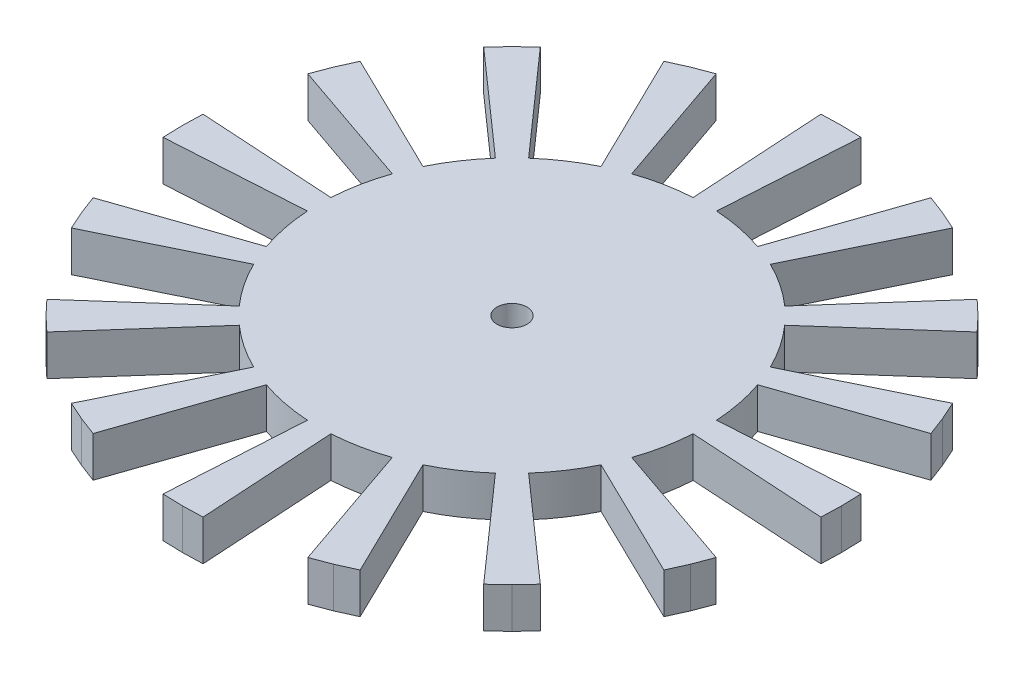
from build123d import *

# Parameters (mm, degrees)
SKETCH2_R           = 1.89865
BOSS_EXTRUDE1_DEPTH = 5.1308


with BuildPart() as part:
    # Sketch2 → Boss-Extrude1 (new body)
    with BuildSketch(Plane(origin=(0, 0, 0), x_dir=(1, 0, 0), z_dir=(0, 1, 0))):
        with BuildLine():
            Line((-13.614547531, 39.502698446), (-15.989661855, 38.602458507))
            Line((-15.989661855, 38.602458507), (-18.305687065, 37.559564828))
            Line((-18.305687065, 37.559564828), (-10.733030501, 22.022006247))
            ThreePointArc((-10.733030501, 22.022006247), (-13.61052624, 20.369592003), (-16.238327885, 18.34348414))
            Line((-16.238327885, 18.34348414), (-27.695230037, 31.285672794))
            Line((-27.695230037, 31.285672794), (-29.545042638, 29.545042638))
            Line((-29.545042638, 29.545042638), (-31.285672794, 27.695230037))
            Line((-31.285672794, 27.695230037), (-18.34348414, 16.238327885))
            ThreePointArc((-18.34348414, 16.238327885), (-20.369592003, 13.61052624), (-22.022006247, 10.733030501))
            Line((-22.022006247, 10.733030501), (-37.559564828, 18.305687065))
            Line((-37.559564828, 18.305687065), (-38.602458507, 15.989661855))
            Line((-38.602458507, 15.989661855), (-39.502698446, 13.614547531))
            Line((-39.502698446, 13.614547531), (-23.161308603, 7.982511303))
            ThreePointArc((-23.161308603, 7.982511303), (-24.027572035, 4.779381236), (-24.453033788, 1.488570263))
            Line((-24.453033788, 1.488570263), (-41.705796353, 2.538826421))
            Line((-41.705796353, 2.538826421), (-41.783, 0))
            Line((-41.783, 0), (-41.705796353, -2.538826421))
            Line((-41.705796353, -2.538826421), (-24.453033788, -1.488570263))
            ThreePointArc((-24.453033788, -1.488570263), (-24.027572035, -4.779381236), (-23.161308603, -7.982511303))
            Line((-23.161308603, -7.982511303), (-39.502698446, -13.614547531))
            Line((-39.502698446, -13.614547531), (-38.602458507, -15.989661855))
            Line((-38.602458507, -15.989661855), (-37.559564828, -18.305687065))
            Line((-37.559564828, -18.305687065), (-22.022006247, -10.733030501))
            ThreePointArc((-22.022006247, -10.733030501), (-20.369592003, -13.61052624), (-18.34348414, -16.238327885))
            Line((-18.34348414, -16.238327885), (-31.285672794, -27.695230037))
            Line((-31.285672794, -27.695230037), (-29.545042638, -29.545042638))
            Line((-29.545042638, -29.545042638), (-27.695230037, -31.285672794))
            Line((-27.695230037, -31.285672794), (-16.238327885, -18.34348414))
            ThreePointArc((-16.238327885, -18.34348414), (-13.61052624, -20.369592003), (-10.733030501, -22.022006247))
            Line((-10.733030501, -22.022006247), (-18.305687065, -37.559564828))
            Line((-18.305687065, -37.559564828), (-15.989661855, -38.602458507))
            Line((-15.989661855, -38.602458507), (-13.614547531, -39.502698446))
            Line((-13.614547531, -39.502698446), (-7.982511303, -23.161308603))
            ThreePointArc((-7.982511303, -23.161308603), (-4.779381236, -24.027572035), (-1.488570263, -24.453033788))
            Line((-1.488570263, -24.453033788), (-2.538826421, -41.705796353))
            Line((-2.538826421, -41.705796353), (0, -41.783))
            Line((0, -41.783), (2.538826421, -41.705796353))
            Line((2.538826421, -41.705796353), (1.488570263, -24.453033788))
            ThreePointArc((1.488570263, -24.453033788), (4.779381236, -24.027572035), (7.982511303, -23.161308603))
            Line((7.982511303, -23.161308603), (13.614547531, -39.502698446))
            Line((13.614547531, -39.502698446), (15.989661855, -38.602458507))
            Line((15.989661855, -38.602458507), (18.305687065, -37.559564828))
            Line((18.305687065, -37.559564828), (10.733030501, -22.022006247))
            ThreePointArc((10.733030501, -22.022006247), (13.61052624, -20.369592003), (16.238327885, -18.34348414))
            Line((16.238327885, -18.34348414), (27.695230037, -31.285672794))
            Line((27.695230037, -31.285672794), (29.545042638, -29.545042638))
            Line((29.545042638, -29.545042638), (31.285672794, -27.695230037))
            Line((31.285672794, -27.695230037), (18.34348414, -16.238327885))
            ThreePointArc((18.34348414, -16.238327885), (20.369592003, -13.61052624), (22.022006247, -10.733030501))
            Line((22.022006247, -10.733030501), (37.559564828, -18.305687065))
            Line((37.559564828, -18.305687065), (38.602458507, -15.989661855))
            Line((38.602458507, -15.989661855), (39.502698446, -13.614547531))
            Line((39.502698446, -13.614547531), (23.161308603, -7.982511303))
            ThreePointArc((23.161308603, -7.982511303), (24.027572035, -4.779381236), (24.453033788, -1.488570263))
            Line((24.453033788, -1.488570263), (41.705796353, -2.538826421))
            Line((41.705796353, -2.538826421), (41.783, 0))
            Line((41.783, 0), (41.705796353, 2.538826421))
            Line((41.705796353, 2.538826421), (24.453033788, 1.488570263))
            ThreePointArc((24.453033788, 1.488570263), (24.027572035, 4.779381236), (23.161308603, 7.982511303))
            Line((23.161308603, 7.982511303), (39.502698446, 13.614547531))
            Line((39.502698446, 13.614547531), (38.602458507, 15.989661855))
            Line((38.602458507, 15.989661855), (37.559564828, 18.305687065))
            Line((37.559564828, 18.305687065), (22.022006247, 10.733030501))
            ThreePointArc((22.022006247, 10.733030501), (20.369592003, 13.61052624), (18.34348414, 16.238327885))
            Line((18.34348414, 16.238327885), (31.285672794, 27.695230037))
            Line((31.285672794, 27.695230037), (29.545042638, 29.545042638))
            Line((29.545042638, 29.545042638), (27.695230037, 31.285672794))
            Line((27.695230037, 31.285672794), (16.238327885, 18.34348414))
            ThreePointArc((16.238327885, 18.34348414), (13.61052624, 20.369592003), (10.733030501, 22.022006247))
            Line((10.733030501, 22.022006247), (18.305687065, 37.559564828))
            Line((18.305687065, 37.559564828), (15.989661855, 38.602458507))
            Line((15.989661855, 38.602458507), (13.614547531, 39.502698446))
            Line((13.614547531, 39.502698446), (7.982511303, 23.161308603))
            ThreePointArc((7.982511303, 23.161308603), (4.779381236, 24.027572035), (1.488570263, 24.453033788))
            Line((1.488570263, 24.453033788), (2.538826421, 41.705796353))
            Line((2.538826421, 41.705796353), (0, 41.783))
            Line((0, 41.783), (-2.538826421, 41.705796353))
            Line((-2.538826421, 41.705796353), (-1.488570263, 24.453033788))
            ThreePointArc((-1.488570263, 24.453033788), (-4.779381236, 24.027572035), (-7.982511303, 23.161308603))
            Line((-7.982511303, 23.161308603), (-13.614547531, 39.502698446))
        make_face()
        Circle(SKETCH2_R, mode=Mode.SUBTRACT)
    extrude(amount=BOSS_EXTRUDE1_DEPTH)


solid = part.part
